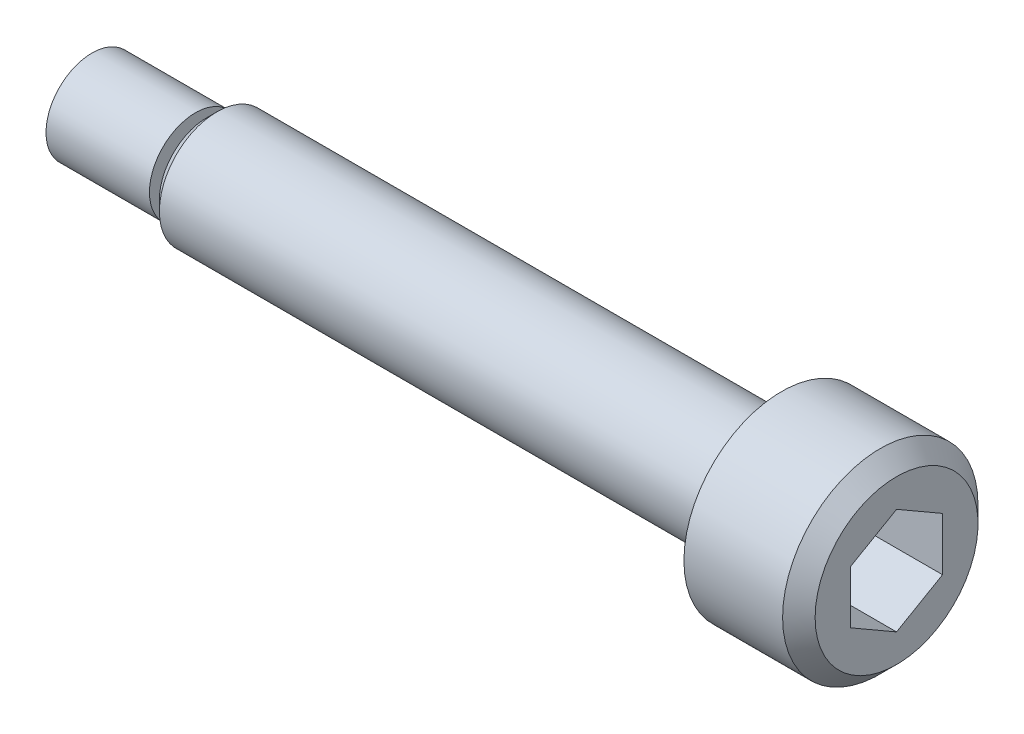
from build123d import *

# Parameters (mm, degrees)
CUT_EXTRUDE_1_DEPTH = 4


with BuildPart() as part:
    # 草图1 → 旋转1 (revolve)
    with BuildSketch(Plane.XY):
        Polygon((-5, 0), (-5, 2), (-0.5, 2), (-0.5, 1.3), (0, 1.3), (0, 2.067), (0.433, 2.5), (25, 2.5), (25, 4.25), (29.292893219, 4.25), (30, 3.542893219), (30, 0), align=None)
    revolve(axis=Axis((30, 0, 0), (-1, 0, 0)))

    # 草图2 → 切除-旋转1 (revolve, cut)
    with BuildSketch(Plane.XY):
        Polygon((24.845299462, 0), (26, 2), (30, 2), (30, 0), align=None)
    revolve(axis=Axis((30, 0, 0), (-1, 0, 0)), mode=Mode.SUBTRACT)

    # 草图3 → 切除-拉伸1 (cut)
    with BuildSketch(Plane(origin=(30, 0, 0), x_dir=(0, 0, -1), z_dir=(1, 0, 0))):
        Polygon((-2, 1.154700538), (-2, -1.154700538), (0, -2.309401077), (2, -1.154700538), (2, 1.154700538), (0, 2.309401077), align=None)
    extrude(amount=-CUT_EXTRUDE_1_DEPTH, mode=Mode.SUBTRACT)


solid = part.part
